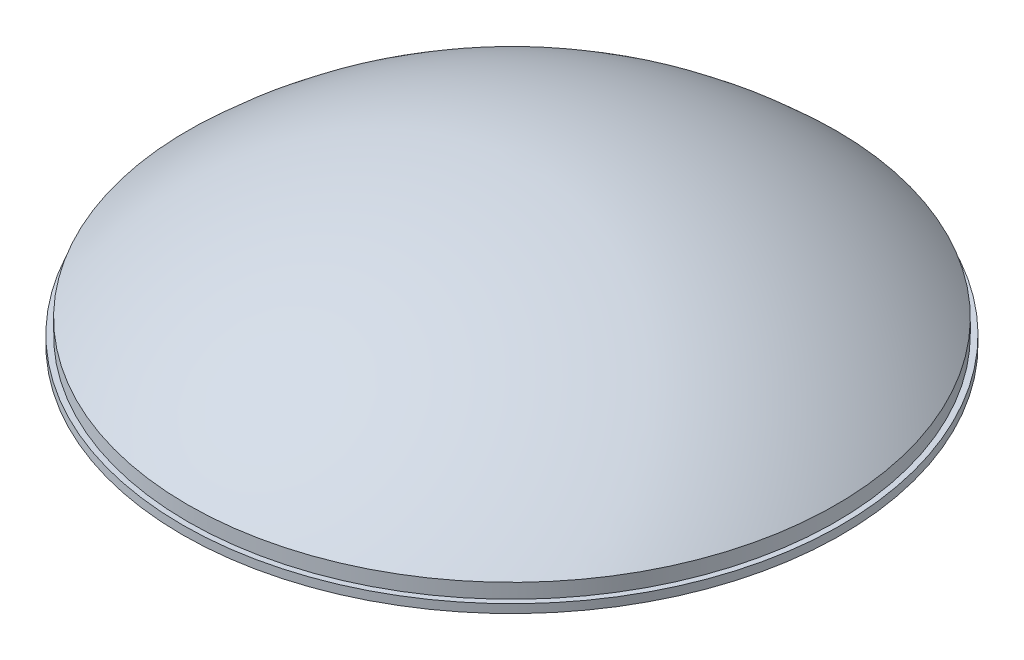
from build123d import *


with BuildPart() as part:
    # Sketch2 → Revolve1 (revolve)
    with BuildSketch(Plane(origin=(0, 0, 0), x_dir=(0, 0, -1), z_dir=(1, 0, 0))):
        with BuildLine():
            Line((242.5, 236.958329575), (242.5, 241.2560898))
            Line((242.5, 241.2560898), (238.5, 241.2560898))
            Line((238.5, 241.2560898), (238.5, 252.045134847))
            ThreePointArc((238.5, 252.045134847), (128.353687536, 322.388478231), (0, 347))
            Line((0, 347), (0, 332))
            ThreePointArc((0, 332), (126.922374282, 306.781210159), (234.562648062, 234.9560898))
            Line((234.562648062, 234.9560898), (242.5, 234.9560898))
            Line((242.5, 234.9560898), (242.5, 236.958329575))
        make_face()
    revolve(axis=Axis((0, 347, 0), (0, -1, 0)))


solid = part.part
